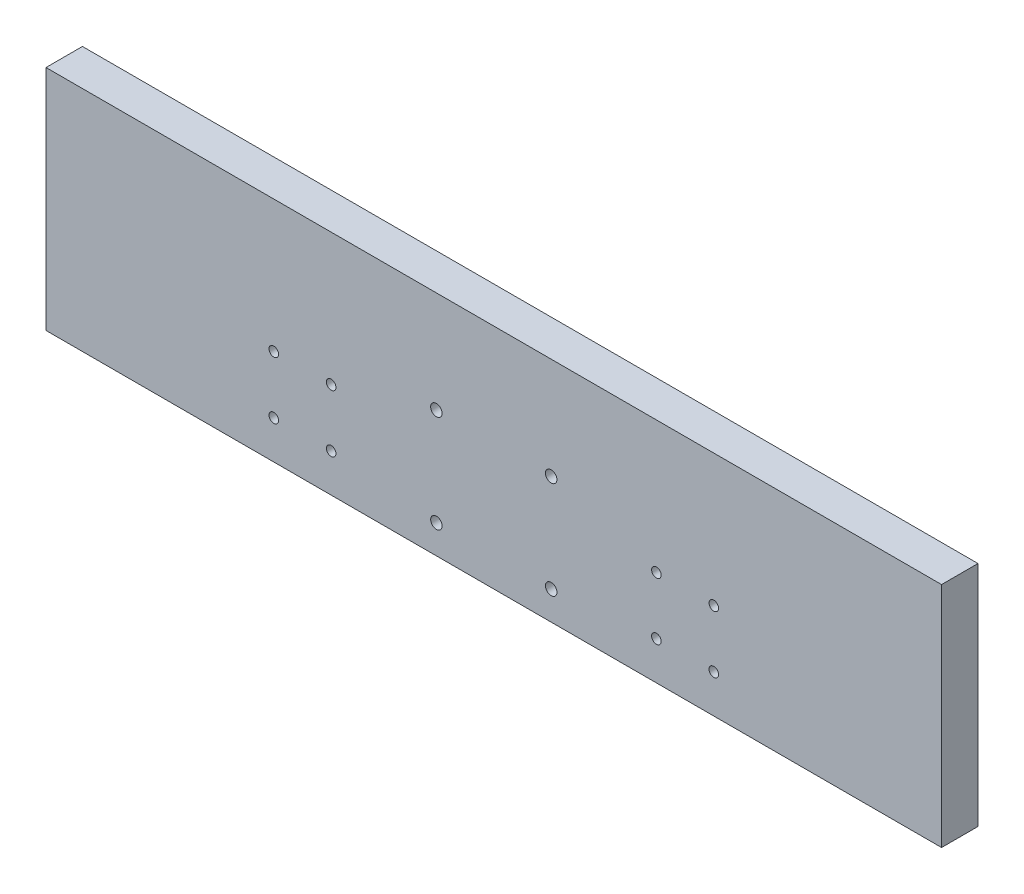
from build123d import *

# Parameters (mm, degrees)
SKETCH1_W                = 468.1
SKETCH1_H                = 119.05
BOSS_EXTRUDE1_DEPTH      = 19.05
M5_CLEARANCE_HOLE1_D     = 5
M5_CLEARANCE_HOLE1_DEPTH = 28.497848452
M5_CLEARANCE_HOLE1_TIP   = 1.502151548
M5_CLEARANCE_HOLE2_D     = 6
M5_CLEARANCE_HOLE2_DEPTH = 28.197418143
M5_CLEARANCE_HOLE2_TIP   = 1.802581857


with BuildPart() as part:
    # Sketch1 → Boss-Extrude1 (new body)
    with BuildSketch(Plane.XY):
        with Locations((0, 59.525)):
            Rectangle(SKETCH1_W, SKETCH1_H)
    extrude(amount=BOSS_EXTRUDE1_DEPTH)

    # M5 Clearance Hole1
    with Locations(Plane(origin=(0, 0, 0), x_dir=(-1, 0, 0), z_dir=(0, 0, -1))):
        with Locations((-115, 20), (-115, 50), (-85, 50), (-85, 20), (85, 20), (85, 50), (115, 50), (115, 20)):
            Hole(M5_CLEARANCE_HOLE1_D / 2, depth=M5_CLEARANCE_HOLE1_DEPTH)
            with Locations((0, 0, -(M5_CLEARANCE_HOLE1_DEPTH + M5_CLEARANCE_HOLE1_TIP / 2))):  # 118° drill point
                Cone(0, M5_CLEARANCE_HOLE1_D / 2, M5_CLEARANCE_HOLE1_TIP, mode=Mode.SUBTRACT)

    # M5 Clearance Hole2
    with Locations(Plane(origin=(0, 0, 0), x_dir=(-1, 0, 0), z_dir=(0, 0, -1))):
        with Locations((30, 15), (30, 66), (-30, 15), (-30, 66)):
            Hole(M5_CLEARANCE_HOLE2_D / 2, depth=M5_CLEARANCE_HOLE2_DEPTH)
            with Locations((0, 0, -(M5_CLEARANCE_HOLE2_DEPTH + M5_CLEARANCE_HOLE2_TIP / 2))):  # 118° drill point
                Cone(0, M5_CLEARANCE_HOLE2_D / 2, M5_CLEARANCE_HOLE2_TIP, mode=Mode.SUBTRACT)


solid = part.part
